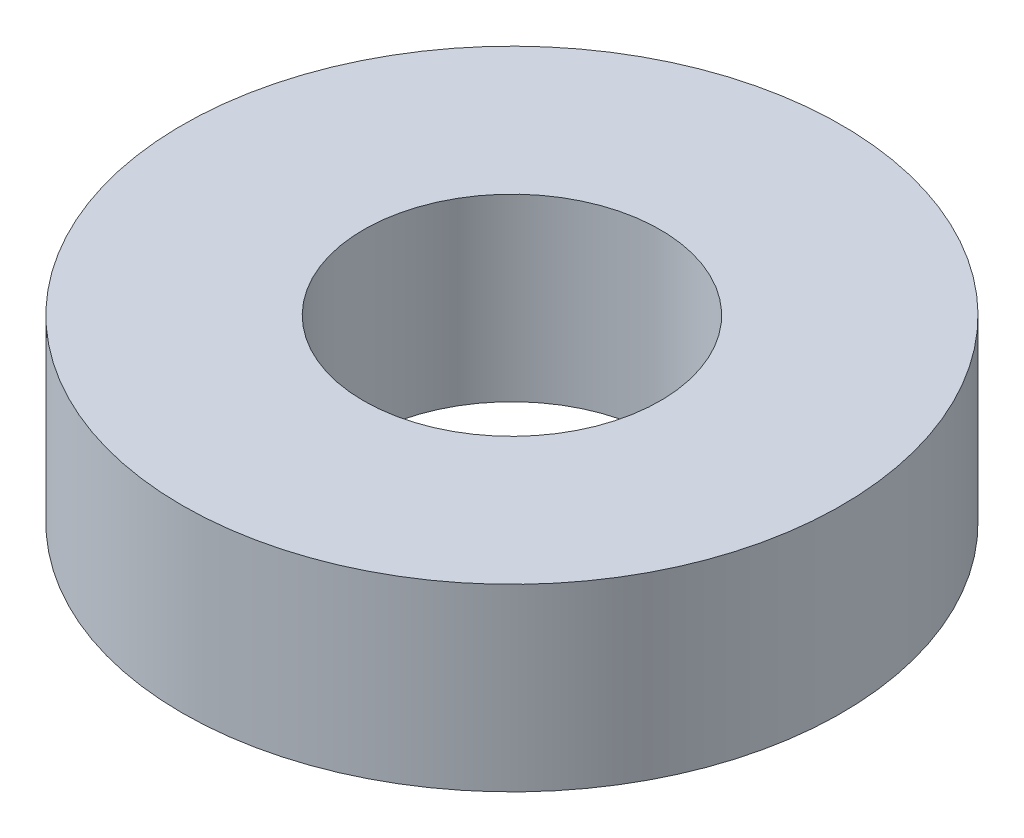
from build123d import *

# Parameters (mm, degrees)
SKETCH1_R           = 11
SKETCH1_R_2         = 4.95
BOSS_EXTRUDE1_DEPTH = 6


with BuildPart() as part:
    # Sketch1 → Boss-Extrude1 (new body)
    with BuildSketch(Plane(origin=(0, 0, 0), x_dir=(1, 0, 0), z_dir=(0, 1, 0))):
        with Locations(Location((0, 0, 0), (0, 0, 270))):
            Circle(SKETCH1_R)
        with Locations(Location((0, 0, 0), (0, 0, 270))):
            Circle(SKETCH1_R_2, mode=Mode.SUBTRACT)
    extrude(amount=BOSS_EXTRUDE1_DEPTH)


solid = part.part
